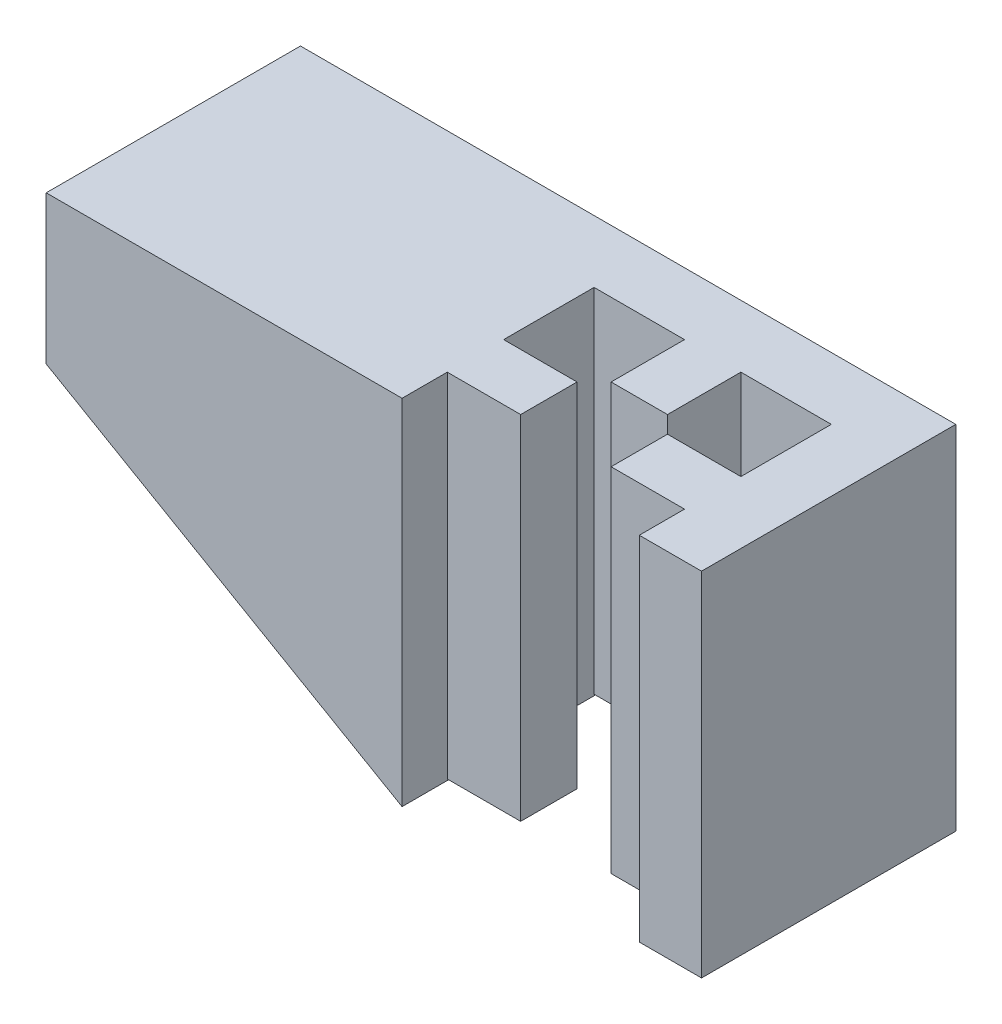
from build123d import *

# Parameters (mm, degrees)
BOSS_EXTRU_1_DEPTH                               = 15
ESQUISSE1_W                                      = 21.65
ESQUISSE1_H                                      = 30
BOSS_EXTRU_2_DEPTH                               = 25
ESQUISSE3_W                                      = 30.3
ESQUISSE3_H                                      = 21.65
BOSS_EXTRU_3_DEPTH                               = 25
ENL_V_MAT_EXTRU_2_DEPTH                          = 61.834878976
ENL_V_MAT_EXTRU_2_DEPTH_BACK                     = 61.834878976
CHAMBRAGE_POUR_VIS_T_TE_RONDE_BOMB_E_D           = 1.778
CHAMBRAGE_POUR_VIS_T_TE_RONDE_BOMB_E_DEPTH       = 12
CHAMBRAGE_POUR_VIS_T_TE_RONDE_BOMB_E_CBORE_D     = 3.57124
CHAMBRAGE_POUR_VIS_T_TE_RONDE_BOMB_E_CBORE_DEPTH = 1.1176
CHAMBRAGE_POUR_VIS_T_TE_RONDE_BOMB_E_TIP         = 0.53416509


with BuildPart() as part:
    # Base → Boss.-Extru.1 (new, symmetric)
    with BuildSketch(Plane(origin=(0, 0, 0), x_dir=(1, 0, 0), z_dir=(0, 1, 0))):
        Polygon((-3.85, -2.4), (-3.85, 2.4), (-10.1, 2.4), (-10.1, 10.1), (-2.4, 10.1), (-2.4, 3.85), (2.4, 3.85), (2.4, 10.1), (10.1, 10.1), (10.1, 2.4), (3.85, 2.4), (3.85, -2.4), (10.1, -2.4), (10.1, -6.25), (15.4, -6.25), (15.4, 15.4), (-15.4, 15.4), (-15.4, -6.25), (-10.1, -6.25), (-10.1, -2.4), align=None)
    extrude(amount=BOSS_EXTRU_1_DEPTH, both=True)

    # Esquisse1 → Boss.-Extru.2 (add)
    with BuildSketch(Plane.ZY.offset(15.4)):
        with Locations((-4.575, 0)):
            Rectangle(ESQUISSE1_W, ESQUISSE1_H)
    extrude(amount=BOSS_EXTRU_2_DEPTH)

    # Esquisse3 → Boss.-Extru.3 (add)
    with BuildSketch(Plane.XZ.offset(15)):
        with Locations((-25.25, -4.575)):
            Rectangle(ESQUISSE3_W, ESQUISSE3_H)
    extrude(amount=BOSS_EXTRU_3_DEPTH)

    # Esquisse4 → Enlèv. mat.-Extru.2 (cut, two sides: drawn at the far end of the back side and taken through both)
    with BuildSketch(Plane.XY.offset(6.25).offset(-ENL_V_MAT_EXTRU_2_DEPTH_BACK)):
        Polygon((119.921926151, -90.183707408), (-10.1, -15.115513344), (-40.4, 2.378199813), (-170.421926151, 77.446393876), (-320.558314278, -182.597458425), (-30.214461977, -350.227559709), align=None)
    extrude(amount=ENL_V_MAT_EXTRU_2_DEPTH + ENL_V_MAT_EXTRU_2_DEPTH_BACK, mode=Mode.SUBTRACT)

    # Chambrage pour vis à tête ronde bombée #02
    with Locations(Plane(origin=(-9.070209274, -15.710063297, 0), x_dir=(-0.8660254037844364, 0.5000000000000041, 0), z_dir=(-0.500000000000004, -0.8660254037844363, 0))):
        with Locations((18.233273003, 4.443374623)):
            CounterBoreHole(CHAMBRAGE_POUR_VIS_T_TE_RONDE_BOMB_E_D / 2, CHAMBRAGE_POUR_VIS_T_TE_RONDE_BOMB_E_CBORE_D / 2, CHAMBRAGE_POUR_VIS_T_TE_RONDE_BOMB_E_CBORE_DEPTH, depth=CHAMBRAGE_POUR_VIS_T_TE_RONDE_BOMB_E_DEPTH)
            with Locations((0, 0, -(CHAMBRAGE_POUR_VIS_T_TE_RONDE_BOMB_E_DEPTH + CHAMBRAGE_POUR_VIS_T_TE_RONDE_BOMB_E_TIP / 2))):  # 118° drill point
                Cone(0, CHAMBRAGE_POUR_VIS_T_TE_RONDE_BOMB_E_D / 2, CHAMBRAGE_POUR_VIS_T_TE_RONDE_BOMB_E_TIP, mode=Mode.SUBTRACT)


solid = part.part
